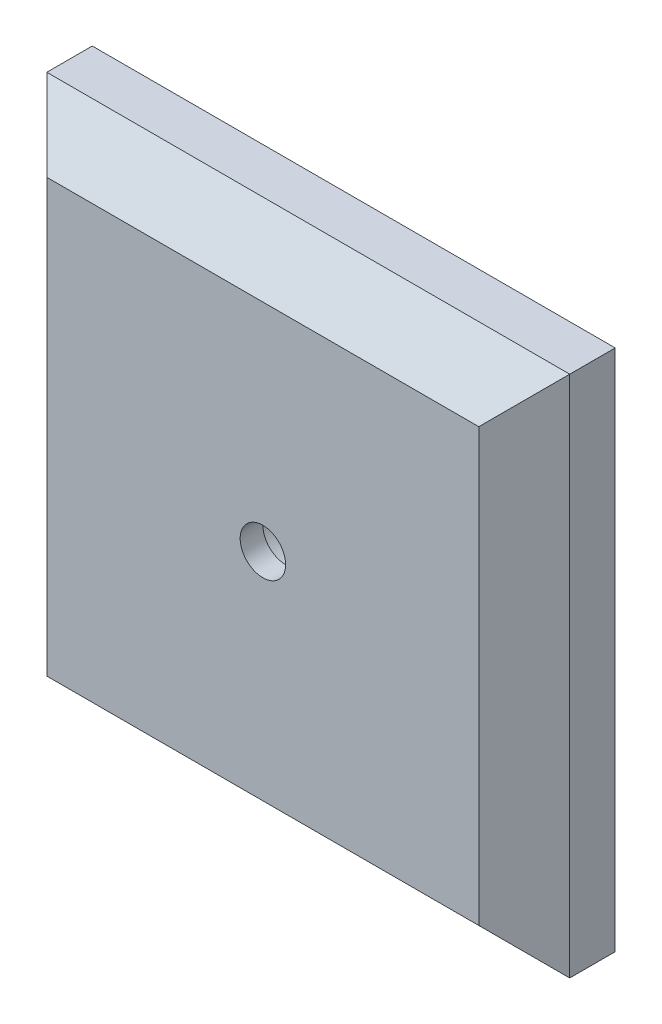
from build123d import *

# Parameters (mm, degrees)
SKETCH2_W           = 73.025
SKETCH2_H           = 73.025
BOSS_EXTRUDE1_DEPTH = 6.35
SKETCH3_W           = 73.025
SKETCH3_H           = 73.025
BOSS_EXTRUDE2_DEPTH = 6.35
SKETCH8_R           = 3.175
CUT_EXTRUDE3_DEPTH  = 3.175
SKETCH4_R           = 6.35
CUT_EXTRUDE4_DEPTH  = 9.525
CHAMFER1_SIZE       = 6.35


with BuildPart() as part:
    # Sketch2 → Boss-Extrude1 (new body)
    with BuildSketch(Plane.XY):
        with Locations((-1.621149573, 1.517306268)):
            Rectangle(SKETCH2_W, SKETCH2_H)
    extrude(amount=BOSS_EXTRUDE1_DEPTH)

    # Sketch3 → Boss-Extrude2 (add)
    with BuildSketch(Plane.XY.offset(6.35)):
        with Locations((-1.621149573, 1.517306268)):
            Rectangle(SKETCH3_W, SKETCH3_H)
    extrude(amount=BOSS_EXTRUDE2_DEPTH)

    # Sketch8 → Cut-Extrude3 (cut)
    with BuildSketch(Plane.XY.offset(12.7)):
        with Locations((-1.608449573, 1.504606268)):
            Circle(SKETCH8_R)
    extrude(amount=-CUT_EXTRUDE3_DEPTH, mode=Mode.SUBTRACT)

    # Sketch4 → Cut-Extrude4 (cut)
    with BuildSketch(Plane(origin=(0, 0, 0), x_dir=(-1, 0, 0), z_dir=(0, 0, -1))):
        with Locations((1.608449573, 1.504606268)):
            Circle(SKETCH4_R)
    extrude(amount=-CUT_EXTRUDE4_DEPTH, mode=Mode.SUBTRACT)

    # Chamfer1
    chamfer1_edges = [part.edges().sort_by_distance(p)[0] for p in [
        (-38.133649573, 1.517306268, 12.7),
        (-1.621149573, -34.995193732, 12.7),
        (34.891350427, 1.517306268, 12.7),
        (-1.621149573, 38.029806268, 12.7),
    ]]
    chamfer(chamfer1_edges, length=CHAMFER1_SIZE)


solid = part.part
